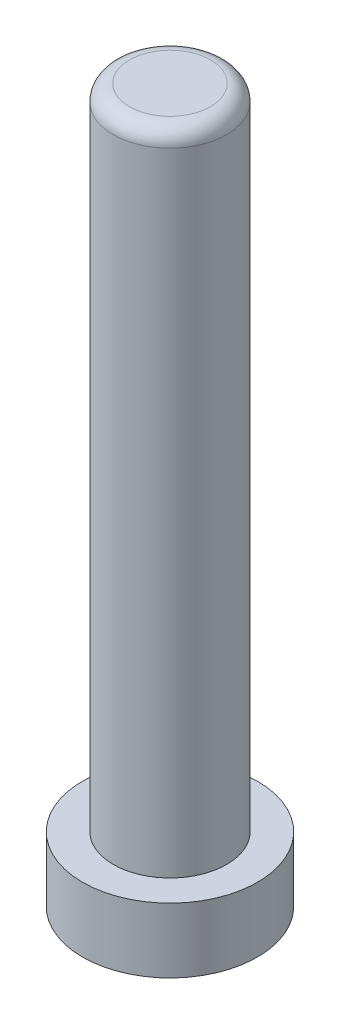
from build123d import *

# Parameters (mm, degrees)
SKETCH1_R           = 2.7
BOSS_EXTRUDE1_DEPTH = 2
SKETCH3_R           = 0.95
CUT_EXTRUDE2_DEPTH  = 9.5
SKETCH7_R           = 1.2
CUT_EXTRUDE4_DEPTH  = 2.8
SKETCH2_R           = 1.75
BOSS_EXTRUDE2_DEPTH = 20
FILLET2_R           = 0.5
SKETCH8_R           = 0.95
CUT_EXTRUDE5_DEPTH  = 9.5


with BuildPart() as part:
    # Sketch1 → Boss-Extrude1 (new body)
    with BuildSketch(Plane(origin=(0, 0, 0), x_dir=(1, 0, 0), z_dir=(0, 1, 0))):
        with Locations(Location((0, 0, 0), (0, 0, 270))):
            Circle(SKETCH1_R)
    extrude(amount=BOSS_EXTRUDE1_DEPTH)

    # Sketch3 → Cut-Extrude2 (cut)
    with BuildSketch(Plane.XZ):
        with Locations(Location((0, 0, 0), (0, 0, 270))):
            Circle(SKETCH3_R)
    extrude(amount=-CUT_EXTRUDE2_DEPTH, mode=Mode.SUBTRACT)

    # Sketch7 → Cut-Extrude4 (cut)
    with BuildSketch(Plane.XZ):
        with Locations(Location((0, 0, 0), (0, 0, 270))):
            Circle(SKETCH7_R)
    extrude(amount=-CUT_EXTRUDE4_DEPTH, mode=Mode.SUBTRACT)

    # Sketch2 → Boss-Extrude2 (add)
    with BuildSketch(Plane(origin=(0, 2, 0), x_dir=(1, 0, 0), z_dir=(0, 1, 0))):
        with Locations(Location((0, 0, 0), (0, 0, 270))):
            Circle(SKETCH2_R)
    extrude(amount=BOSS_EXTRUDE2_DEPTH)

    # Fillet2
    fillet2_edges = [part.edges().sort_by_distance(p)[0] for p in [
        (0, 22, -1.75),
    ]]
    fillet(fillet2_edges, radius=FILLET2_R)

    # Sketch8 → Cut-Extrude5 (cut)
    with BuildSketch(Plane.XZ):
        with Locations(Location((0, 0, 0), (0, 0, 270))):
            Circle(SKETCH8_R)
    extrude(amount=-CUT_EXTRUDE5_DEPTH, mode=Mode.SUBTRACT)


solid = part.part
